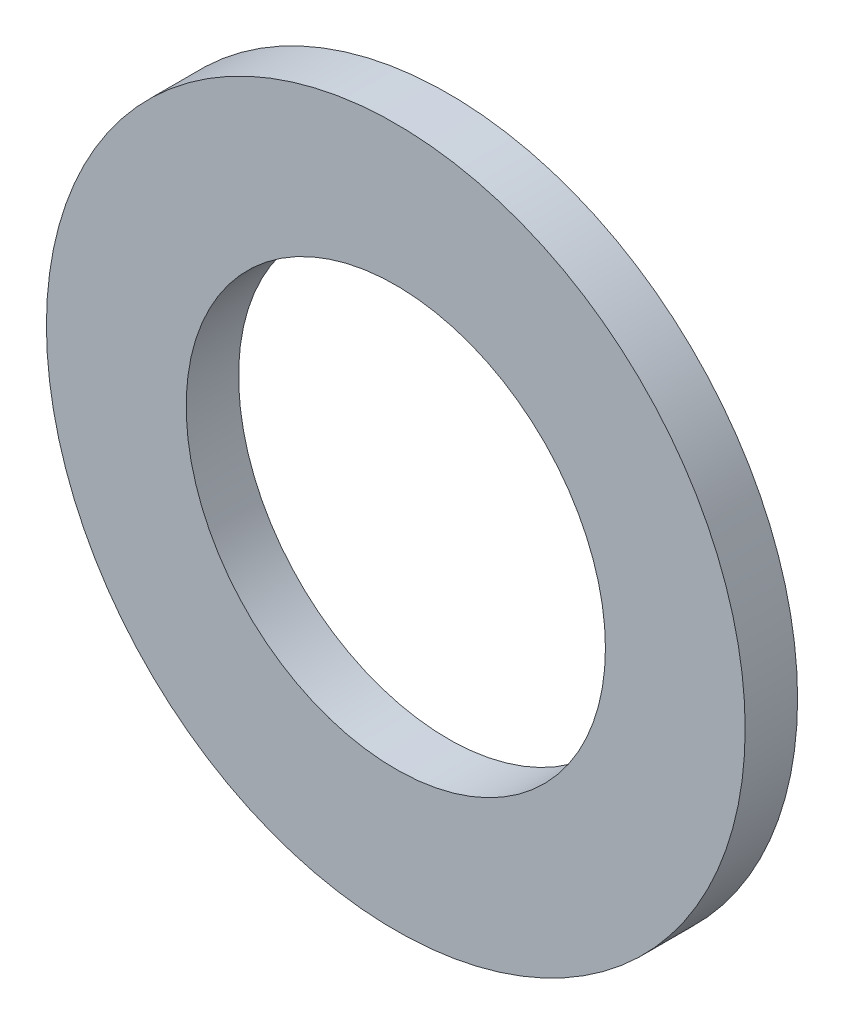
from build123d import *

# Parameters (mm, degrees)
SKETCH1_R           = 10
SKETCH1_R_2         = 6
BOSS_EXTRUDE1_DEPTH = 1.5


with BuildPart() as part:
    # Sketch1 → Boss-Extrude1 (new body)
    with BuildSketch(Plane.XY):
        Circle(SKETCH1_R)
        Circle(SKETCH1_R_2, mode=Mode.SUBTRACT)
    extrude(amount=BOSS_EXTRUDE1_DEPTH)


solid = part.part
